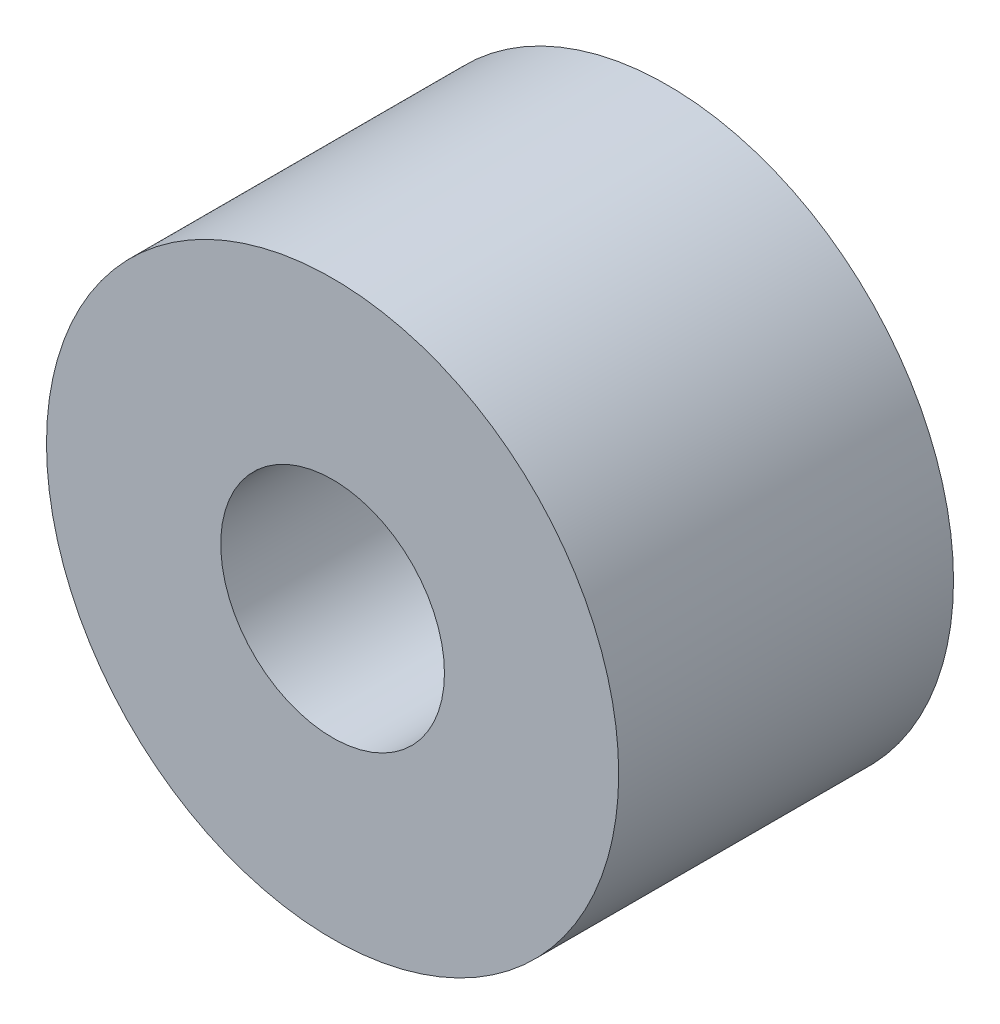
from build123d import *

# Parameters (mm, degrees)
SKETCH1_R           = 4.775
SKETCH1_R_2         = 1.8669
BOSS_EXTRUDE1_DEPTH = 5.588


with BuildPart() as part:
    # Sketch1 → Boss-Extrude1 (new body)
    with BuildSketch(Plane.XY):
        Circle(SKETCH1_R)
        Circle(SKETCH1_R_2, mode=Mode.SUBTRACT)
    extrude(amount=BOSS_EXTRUDE1_DEPTH)


solid = part.part
